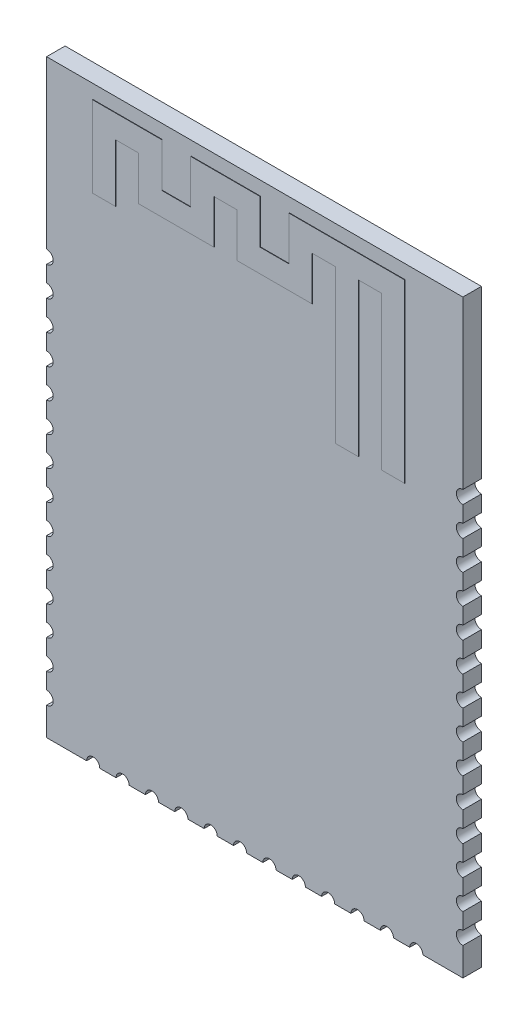
from build123d import *

# Parameters (mm, degrees)
SKICA1_W             = 18
SKICA1_H             = 19.2
BODY_SMALL_DEPTH     = 0.8
SKICA2_W             = 18
SKICA2_H             = 6.3
BODY_EXTENSION_DEPTH = 0.8
SKICA3_R             = 0.284
VIAS_DEPTH           = 19.287974191
ANTENNA_DEPTH        = 0.018


with BuildPart() as part:
    # Skica1 → body_small (new body)
    with BuildSketch(Plane.XY):
        Rectangle(SKICA1_W, SKICA1_H)
    extrude(amount=BODY_SMALL_DEPTH)

    # Skica2 → body_extension (add)
    with BuildSketch(Plane(origin=(0, 0, 0), x_dir=(-1, 0, 0), z_dir=(0, 0, -1))):
        with Locations((0, 12.75)):
            Rectangle(SKICA2_W, SKICA2_H)
    extrude(amount=-BODY_EXTENSION_DEPTH)

    # Skica3 → vias (cut, through all)
    with BuildSketch(Plane.XY.offset(0.8)):
        with Locations((-6.985, -9.6)):
            Circle(SKICA3_R)
        with Locations((-9, -8.1)):
            Circle(SKICA3_R)
        with Locations((9, -8.1)):
            Circle(SKICA3_R)
        with Locations((-9, -6.83)):
            Circle(SKICA3_R)
        with Locations((9, -6.83)):
            Circle(SKICA3_R)
        with Locations((-9, -5.56)):
            Circle(SKICA3_R)
        with Locations((9, -5.56)):
            Circle(SKICA3_R)
        with Locations((-9, -4.29)):
            Circle(SKICA3_R)
        with Locations((9, -4.29)):
            Circle(SKICA3_R)
        with Locations((-9, -3.02)):
            Circle(SKICA3_R)
        with Locations((9, -3.02)):
            Circle(SKICA3_R)
        with Locations((-9, -1.75)):
            Circle(SKICA3_R)
        with Locations((9, -1.75)):
            Circle(SKICA3_R)
        with Locations((-9, -0.48)):
            Circle(SKICA3_R)
        with Locations((9, -0.48)):
            Circle(SKICA3_R)
        with Locations((-9, 0.79)):
            Circle(SKICA3_R)
        with Locations((9, 0.79)):
            Circle(SKICA3_R)
        with Locations((-9, 2.06)):
            Circle(SKICA3_R)
        with Locations((9, 2.06)):
            Circle(SKICA3_R)
        with Locations((-9, 3.33)):
            Circle(SKICA3_R)
        with Locations((9, 3.33)):
            Circle(SKICA3_R)
        with Locations((-9, 4.6)):
            Circle(SKICA3_R)
        with Locations((9, 4.6)):
            Circle(SKICA3_R)
        with Locations((-9, 5.87)):
            Circle(SKICA3_R)
        with Locations((9, 5.87)):
            Circle(SKICA3_R)
        with Locations((-9, 7.14)):
            Circle(SKICA3_R)
        with Locations((9, 7.14)):
            Circle(SKICA3_R)
        with Locations((-9, 8.41)):
            Circle(SKICA3_R)
        with Locations((9, 8.41)):
            Circle(SKICA3_R)
        with Locations((-5.715, -9.6)):
            Circle(SKICA3_R)
        with Locations((-4.445, -9.6)):
            Circle(SKICA3_R)
        with Locations((-3.175, -9.6)):
            Circle(SKICA3_R)
        with Locations((-1.905, -9.6)):
            Circle(SKICA3_R)
        with Locations((-0.635, -9.6)):
            Circle(SKICA3_R)
        with Locations((0.635, -9.6)):
            Circle(SKICA3_R)
        with Locations((1.905, -9.6)):
            Circle(SKICA3_R)
        with Locations((3.175, -9.6)):
            Circle(SKICA3_R)
        with Locations((4.445, -9.6)):
            Circle(SKICA3_R)
        with Locations((5.715, -9.6)):
            Circle(SKICA3_R)
        with Locations((6.985, -9.6)):
            Circle(SKICA3_R)
    extrude(amount=-VIAS_DEPTH, mode=Mode.SUBTRACT)

    # Skica4 → antenna (add)
    with BuildSketch(Plane.XY.offset(0.8)):
        Polygon((-7, 11.8), (-6, 11.8), (-6, 14.3), (-5, 14.3), (-5, 12.4), (-1.75, 12.4), (-1.75, 14.3), (-0.75, 14.3), (-0.75, 12.4), (2.5, 12.4), (2.5, 14.3), (3.5, 14.3), (3.5, 7.68), (4.5, 7.68), (4.5, 14.3), (5.5, 14.3), (5.5, 7.68), (6.5, 7.68), (6.5, 15.3), (1.5, 15.3), (1.5, 13.4), (0.25, 13.4), (0.25, 15.3), (-2.75, 15.3), (-2.75, 13.4), (-4, 13.4), (-4, 15.3), (-7, 15.3), align=None)
    extrude(amount=ANTENNA_DEPTH)


solid = part.part
